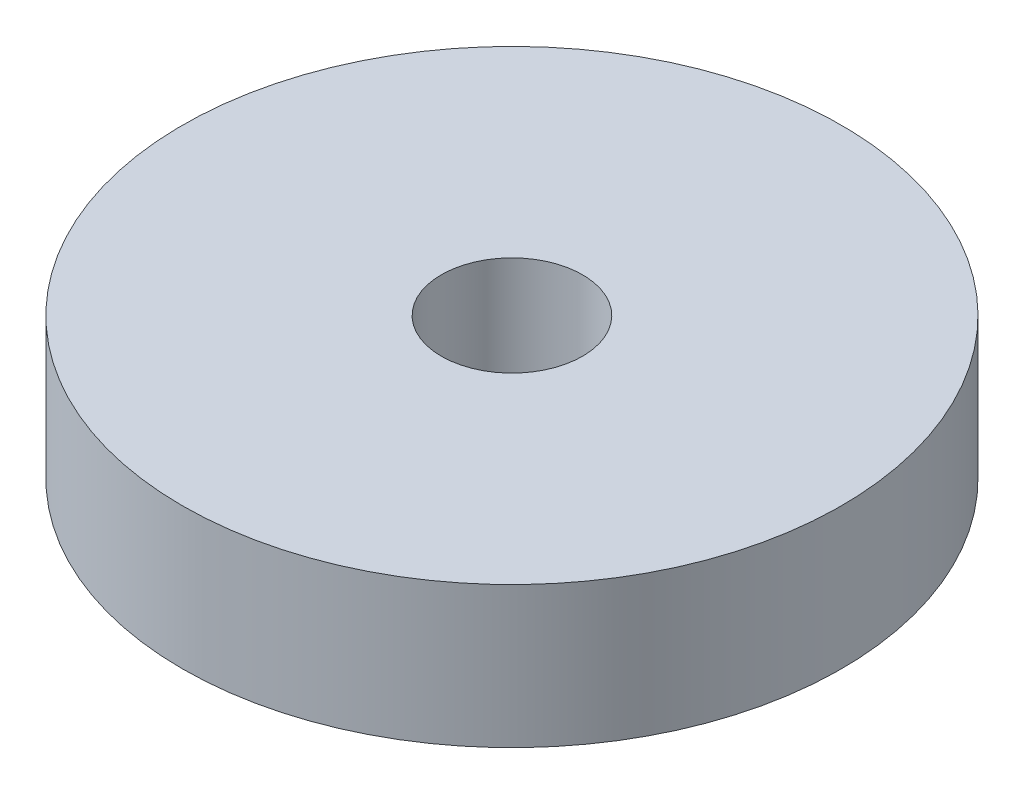
from build123d import *

# Parameters (mm, degrees)
SKETCH1_R           = 7
SKETCH1_R_2         = 1.5
BOSS_EXTRUDE1_DEPTH = 3


with BuildPart() as part:
    # Sketch1 → Boss-Extrude1 (new body)
    with BuildSketch(Plane(origin=(0, 0, 0), x_dir=(1, 0, 0), z_dir=(0, 1, 0))):
        with Locations(Location((0, 0, 0), (0, 0, 270))):
            Circle(SKETCH1_R)
        with Locations(Location((0, 0, 0), (0, 0, 270))):
            Circle(SKETCH1_R_2, mode=Mode.SUBTRACT)
    extrude(amount=BOSS_EXTRUDE1_DEPTH)


solid = part.part
